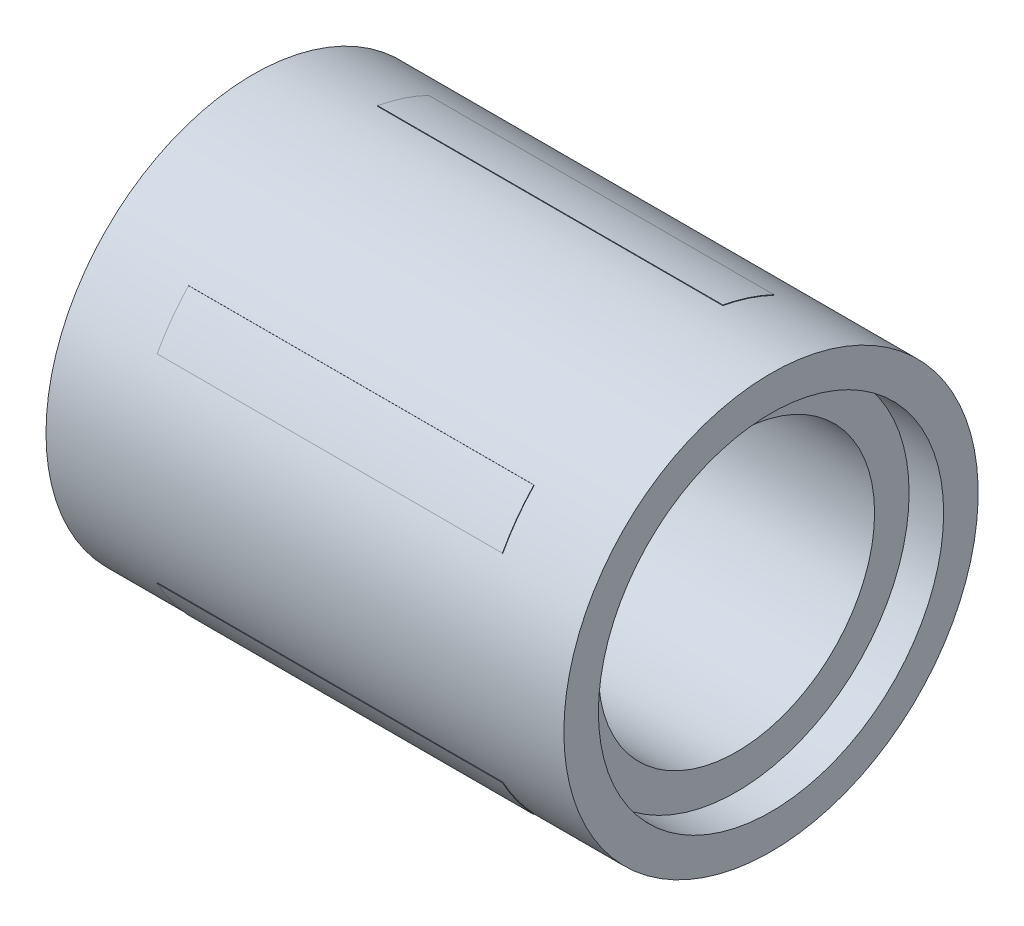
from build123d import *

# Parameters (mm, degrees)
BOSS_EXTRUDE1_DEPTH      = 10
BOSS_EXTRUDE1_DEPTH_BACK = 10
SKETCH2_R                = 8.5


with BuildPart() as part:
    # Sketch1 → Revolve1 (revolve)
    with BuildSketch(Plane.XY, mode=Mode.PRIVATE) as revolve1_sk:
        Polygon((-15, 10), (-13, 10), (-13, 8), (13, 8), (13, 10), (15, 10), (15, 12), (-15, 12), align=None)
    revolve(revolve1_sk.sketch.rotate(Axis((15, 0, 0), (-1, 0, 0)), 270), axis=Axis((15, 0, 0), (-1, 0, 0)))

    # Sketch2 → Boss-Extrude1 (add, two sides: drawn at the far end of the back side and taken through both)
    with BuildSketch(Plane(origin=(0, 0, 0), x_dir=(0, 0, -1), z_dir=(1, 0, 0)).offset(-BOSS_EXTRUDE1_DEPTH_BACK)):
        with BuildLine():
            Line((-10.129868152, -5.443874651), (-10.562419487, -5.758141591))
            ThreePointArc((-10.562419487, -5.758141591), (-9.732474442, -7.071056585), (-8.740285205, -8.266094273))
            Line((-8.740285205, -8.266094273), (-8.30773387, -7.951827333))
            ThreePointArc((-8.30773387, -7.951827333), (-3.553695435, -10.937149937), (2.047131051, -11.316326898))
            Line((2.047131051, -11.316326898), (2.212350959, -11.824821489))
            ThreePointArc((2.212350959, -11.824821489), (3.717474442, -11.441209891), (5.160626159, -10.866868806))
            Line((5.160626159, -10.866868806), (4.995406251, -10.358374215))
            ThreePointArc((4.995406251, -10.358374215), (9.303695435, -6.759530401), (11.395064721, -1.55))
            Line((11.395064721, -1.55), (11.929727574, -1.55))
            ThreePointArc((11.929727574, -1.55), (12.03, 0), (11.929727574, 1.55))
            Line((11.929727574, 1.55), (11.395064721, 1.55))
            ThreePointArc((11.395064721, 1.55), (9.303695435, 6.759530401), (4.995406251, 10.358374215))
            Line((4.995406251, 10.358374215), (5.160626159, 10.866868806))
            ThreePointArc((5.160626159, 10.866868806), (3.717474442, 11.441209891), (2.212350959, 11.824821489))
            Line((2.212350959, 11.824821489), (2.047131051, 11.316326898))
            ThreePointArc((2.047131051, 11.316326898), (-3.553695435, 10.937149937), (-8.30773387, 7.951827333))
            Line((-8.30773387, 7.951827333), (-8.740285205, 8.266094273))
            ThreePointArc((-8.740285205, 8.266094273), (-9.732474442, 7.071056585), (-10.562419487, 5.758141591))
            Line((-10.562419487, 5.758141591), (-10.129868152, 5.443874651))
            ThreePointArc((-10.129868152, 5.443874651), (-11.5, 0), (-10.129868152, -5.443874651))
        make_face()
        Circle(SKETCH2_R, mode=Mode.SUBTRACT)
    extrude(amount=BOSS_EXTRUDE1_DEPTH + BOSS_EXTRUDE1_DEPTH_BACK)


solid = part.part
